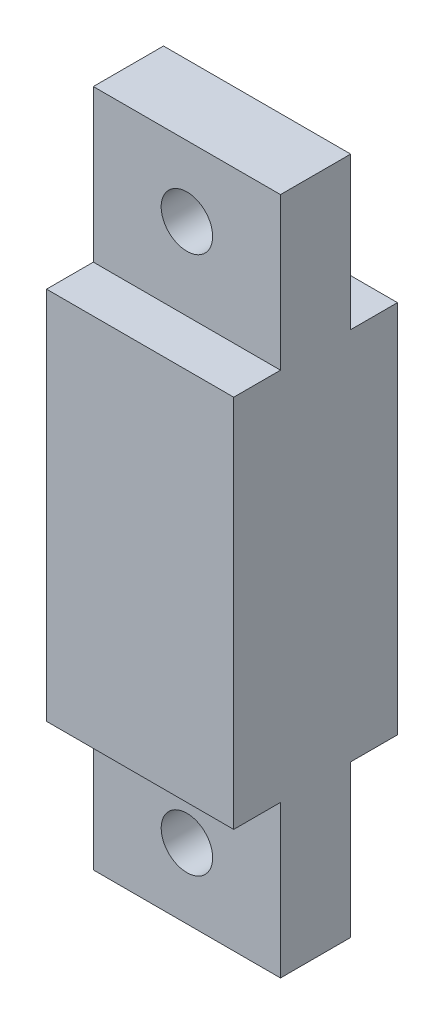
from build123d import *

# Parameters (mm, degrees)
SKETCH_1_W            = 8
SKETCH_1_H            = 29
EXTRUDE_269_DEPTH     = 3
SKETCH_2_W            = 8
SKETCH_2_H            = 16
EXTRUDE_389_DEPTH     = 2
EXTRUDE_START         = 3
SKETCH_2_2_W          = 8
SKETCH_2_2_H          = 16
EXTRUDE_440_DEPTH     = 2
CUT_EXTRUDE_651_REACH = 17.851
SKETCH_3_R            = 1.1


with BuildPart() as part:
    # 草图1 → Extrude 269 (new body)
    with BuildSketch(Plane.XY):
        Rectangle(SKETCH_1_W, SKETCH_1_H)
    extrude(amount=EXTRUDE_269_DEPTH)

    # 草图2 → Extrude 389 (add)
    with BuildSketch(Plane.XY):
        Rectangle(SKETCH_2_W, SKETCH_2_H)
    extrude(amount=-EXTRUDE_389_DEPTH)

    # 草图2<2> → Extrude 440 (add)
    with BuildSketch(Plane.XY.offset(EXTRUDE_START)):
        Rectangle(SKETCH_2_2_W, SKETCH_2_2_H)
    extrude(amount=EXTRUDE_440_DEPTH)

    # 草图3 → Cut-Extrude 651 (cut, up to next)
    with BuildSketch(Plane.XY.offset(3), mode=Mode.PRIVATE) as cut_extrude_651_sk1:
        with Locations((0, 11.5)):
            Circle(SKETCH_3_R)
    cut_extrude_651_tool1 = extrude(cut_extrude_651_sk1.sketch, amount=-CUT_EXTRUDE_651_REACH, mode=Mode.PRIVATE) & part.part
    # 草图3 → Cut-Extrude 651 (cut, up to next)
    with BuildSketch(Plane.XY.offset(3), mode=Mode.PRIVATE) as cut_extrude_651_sk2:
        with Locations((0, -11.5)):
            Circle(SKETCH_3_R)
    cut_extrude_651_tool2 = extrude(cut_extrude_651_sk2.sketch, amount=-CUT_EXTRUDE_651_REACH, mode=Mode.PRIVATE) & part.part
    add(cut_extrude_651_tool1.solids().sort_by_distance((0, 11.5, 3))[0], mode=Mode.SUBTRACT)
    add(cut_extrude_651_tool2.solids().sort_by_distance((0, -11.5, 3))[0], mode=Mode.SUBTRACT)


solid = part.part
